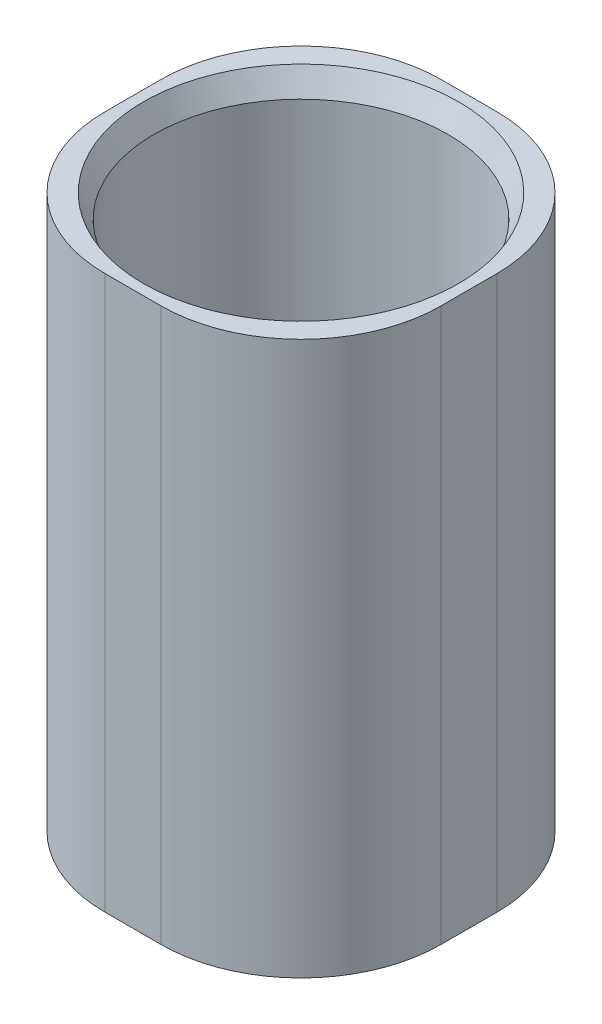
from build123d import *

# Parameters (mm, degrees)
BOSS_EXTRUDE2_START = 1
SKETCH3_W           = 24
SKETCH3_H           = 24
BOSS_EXTRUDE2_DEPTH = 39.5
FILLET1_R           = 10


with BuildPart() as part:
    # Sketch1 → Revolve1 (revolve)
    with BuildSketch(Plane(origin=(0, 0, 0), x_dir=(0, 0, -1), z_dir=(1, 0, 0))):
        Polygon((0, 0), (10.5, 10), (10.5, 38.857142857), (11.25, 40.5), (11.25, 44.5), (0, 44.5), align=None)
    revolve(axis=Axis((0, 0, 0), (0, 1, 0)))


with BuildPart() as body_2:
    # Sketch3 → Boss-Extrude2 (new body)
    with BuildSketch(Plane(origin=(0, 0, 0), x_dir=(1, 0, 0), z_dir=(0, 1, 0)).offset(BOSS_EXTRUDE2_START)):
        Rectangle(SKETCH3_W, SKETCH3_H)
    extrude(amount=BOSS_EXTRUDE2_DEPTH)

    # Combine1: cut part
    add(part.part, mode=Mode.SUBTRACT)

    # Fillet1
    fillet1_edges = [body_2.edges().sort_by_distance(p)[0] for p in [
        (12, 20.75, 12),
        (-12, 20.75, 12),
        (-12, 20.75, -12),
        (12, 20.75, -12),
    ]]
    fillet(fillet1_edges, radius=FILLET1_R)


solid = body_2.part
